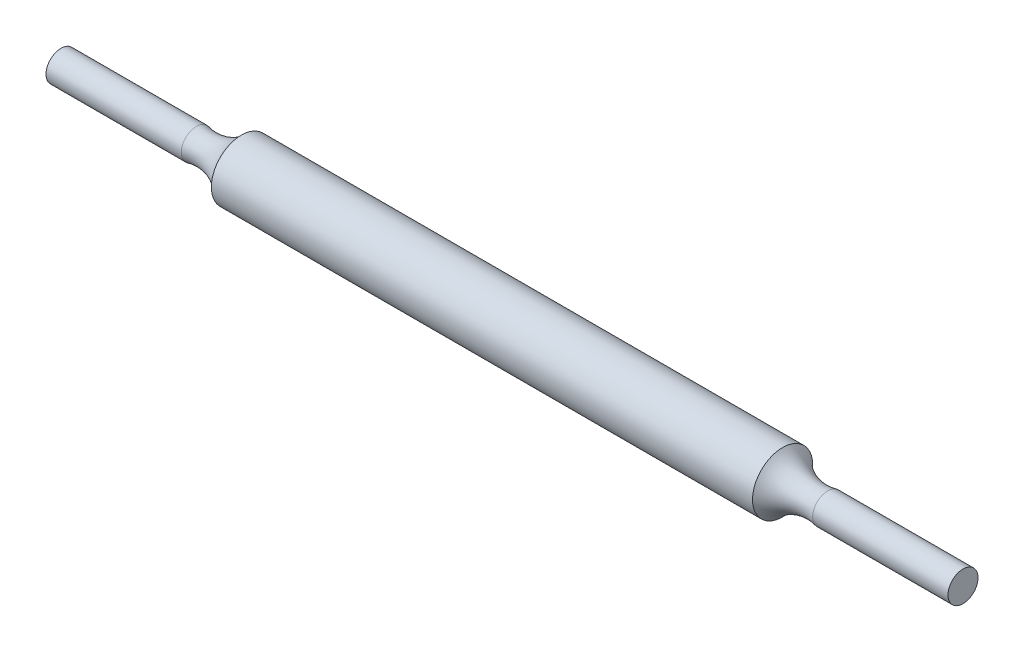
from build123d import *


with BuildPart() as part:
    # Sketch4 → Revolve1 (revolve)
    with BuildSketch(Plane(origin=(0, 0, 0), x_dir=(1, 0, 0), z_dir=(0, 1, 0)), mode=Mode.PRIVATE) as revolve1_sk:
        with BuildLine():
            Line((-18, 2), (18, 2))
            ThreePointArc((18, 2), (19.357542477, 1.07262743), (21, 1))
            Line((21, 1), (30, 1))
            Line((30, 1), (30, 0))
            Line((30, 0), (-30, 0))
            Line((-30, 0), (-30, 1))
            Line((-30, 1), (-21, 1))
            ThreePointArc((-21, 1), (-19.357542477, 1.07262743), (-18, 2))
        make_face()
    revolve(revolve1_sk.sketch.rotate(Axis((-30, 0, 0), (1, 0, 0)), 180), axis=Axis((-30, 0, 0), (1, 0, 0)))


solid = part.part
